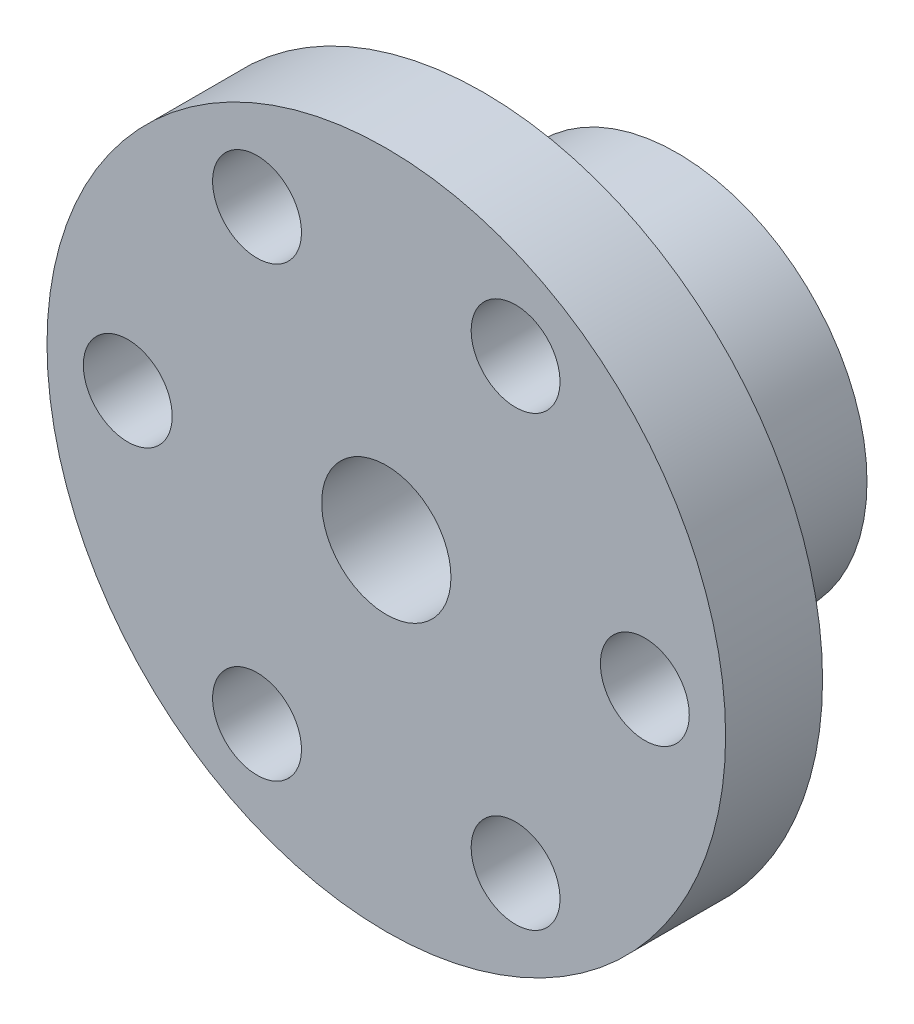
from build123d import *

# Parameters (mm, degrees)
CUT_EXTRUDE_5_DEPTH      = 34.271609519
CUT_EXTRUDE_5_DEPTH_BACK = 34.271609519
SKETCH_8_R               = 4
EXTRUDE_START            = -75
SKETCH_10_R              = 4
EXTRUDE_1_DEPTH          = 150
SKETCH_12_R              = 2.75
CUT_EXTRUDE_6_DEPTH      = 6
PATTERN_CIRCULAR_1_COUNT = 6


with BuildPart() as part:
    # 草图3 → 旋转1 (revolve)
    with BuildSketch(Plane(origin=(0, 0, 0), x_dir=(0, 0, -1), z_dir=(1, 0, 0)), mode=Mode.PRIVATE) as revolve_1_sk:
        Polygon((-3, 0), (-3, 21), (3, 21), (3, 11.75), (15, 11.75), (15, 0), align=None)
    revolve(revolve_1_sk.sketch.rotate(Axis((0, 0, 3), (0, 0, -1)), 90), axis=Axis((0, 0, 3), (0, 0, -1)))

    # 草图8 → 切除-拉伸5 (cut, two sides: drawn at the far end of the back side and taken through both)
    with BuildSketch(Plane.XY.offset(-CUT_EXTRUDE_5_DEPTH_BACK)):
        Circle(SKETCH_8_R)
    extrude(amount=CUT_EXTRUDE_5_DEPTH + CUT_EXTRUDE_5_DEPTH_BACK, mode=Mode.SUBTRACT)

    # 草图12 → 切除-拉伸6 (cut)
    with BuildSketch(Plane.XY.offset(3)):
        with Locations((16, 0)):
            Circle(SKETCH_12_R)
    cut_extrude_6 = extrude(amount=-CUT_EXTRUDE_6_DEPTH, mode=Mode.SUBTRACT)

    # 阵列(圆周)1: 切除-拉伸6 ×6 about axis
    pattern_circular_1_axis = Axis((0, 0, 0), (0, 0, 1))
    for i in range(1, PATTERN_CIRCULAR_1_COUNT):
        add(cut_extrude_6.rotate(pattern_circular_1_axis, i * 360 / PATTERN_CIRCULAR_1_COUNT), mode=Mode.SUBTRACT)


with BuildPart() as body_2:
    # 草图10 → 凸台-拉伸1 (new body)
    with BuildSketch(Plane.XY.offset(EXTRUDE_START)):
        Circle(SKETCH_10_R)
    extrude(amount=EXTRUDE_1_DEPTH)


solid = part.part
